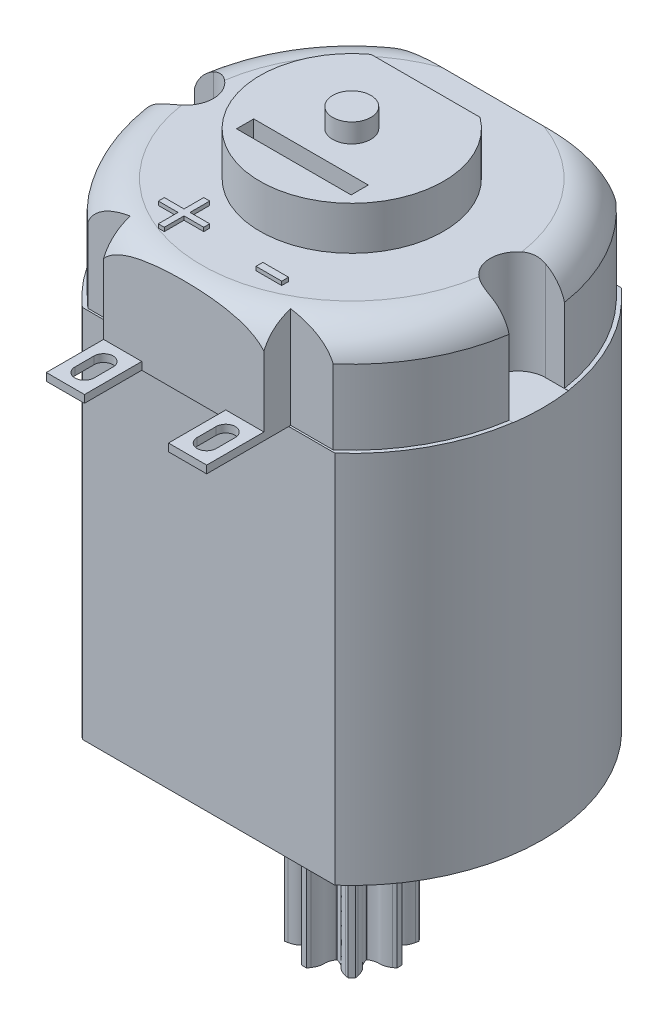
from build123d import *

# Parameters (mm, degrees)
BOSS_EXTRUDE1_DEPTH  = 9.8
BOSS_EXTRUDE2_DEPTH  = 5.4
SKETCH3_W            = 8.4
SKETCH3_H            = 5.4
BOSS_EXTRUDE3_DEPTH  = 1.4
BOSS_EXTRUDE4_DEPTH  = 2.27
SKETCH6_W            = 6
SKETCH6_H            = 0.9
CUT_EXTRUDE1_DEPTH   = 2.27
SKETCH7_R            = 3
BOSS_EXTRUDE5_DEPTH  = 1.7
SKETCH8_R            = 1
BOSS_EXTRUDE6_DEPTH  = 7.8
BOSS_EXTRUDE7_DEPTH  = 5
CUT_EXTRUDE2_DEPTH   = 5.41
BOSS_EXTRUDE8_START  = 1
SKETCH11_R           = 1
BOSS_EXTRUDE8_DEPTH  = 1
SKETCH12_W           = 2
SKETCH12_H           = 0.4
BOSS_EXTRUDE9_DEPTH  = 3
CUT_EXTRUDE3_DEPTH   = 34.309007915
SKETCH14_W           = 1.346153846
SKETCH14_H           = 0.358974359
BOSS_EXTRUDE10_DEPTH = 0.2


with BuildPart() as part:
    # Sketch1 → Boss-Extrude1 (new, symmetric)
    with BuildSketch(Plane(origin=(0, 0, 0), x_dir=(1, 0, 0), z_dir=(0, 1, 0))):
        with BuildLine():
            Line((-6.614378278, 7.5), (6.614378278, 7.5))
            ThreePointArc((6.614378278, 7.5), (10, 0), (6.614378278, -7.5))
            Line((6.614378278, -7.5), (-6.614378278, -7.5))
            ThreePointArc((-6.614378278, -7.5), (-10, 0), (-6.614378278, 7.5))
        make_face()
    extrude(amount=BOSS_EXTRUDE1_DEPTH, both=True)

    # Sketch2 → Boss-Extrude2 (add)
    with BuildSketch(Plane(origin=(0, 9.8, 0), x_dir=(1, 0, 0), z_dir=(0, 1, 0))):
        with BuildLine():
            Line((-6.424951362, 7.4), (6.424951362, 7.4))
            ThreePointArc((6.424951362, 7.4), (9.8, 0), (6.424951362, -7.4))
            Line((6.424951362, -7.4), (-6.424951362, -7.4))
            ThreePointArc((-6.424951362, -7.4), (-9.8, 0), (-6.424951362, 7.4))
        make_face()
    extrude(amount=BOSS_EXTRUDE2_DEPTH)

    # Sketch3 → Boss-Extrude3 (add)
    with BuildSketch(Plane.XY.offset(7.4)):
        with Locations((0, 12.5)):
            Rectangle(SKETCH3_W, SKETCH3_H)
    extrude(amount=BOSS_EXTRUDE3_DEPTH)

    # Sketch4 → Cut-Revolve1 (revolve, cut)
    with BuildSketch(Plane.XY):
        with BuildLine():
            Line((7.863508327, 15.2), (9.8, 15.2))
            Line((9.8, 15.2), (9.8, 13.7))
            ThreePointArc((9.8, 13.7), (9.088253198, 14.78113883), (7.863508327, 15.2))
        make_face()
    revolve(axis=Axis((0, 0, 0), (0, 1, 0)), mode=Mode.SUBTRACT)

    # Sketch5 → Boss-Extrude4 (add)
    with BuildSketch(Plane(origin=(0, 15.2, 0), x_dir=(1, 0, 0), z_dir=(0, 1, 0))):
        with BuildLine():
            Line((-2.854785456, 3.865), (2.854785456, 3.865))
            ThreePointArc((2.854785456, 3.865), (0, -4.805), (-2.854785456, 3.865))
        make_face()
    extrude(amount=BOSS_EXTRUDE4_DEPTH)

    # Sketch6 → Cut-Extrude1 (cut)
    with BuildSketch(Plane(origin=(0, 17.47, 0), x_dir=(1, 0, 0), z_dir=(0, 1, 0))):
        with Locations((0, -2.585)):
            Rectangle(SKETCH6_W, SKETCH6_H)
    extrude(amount=-CUT_EXTRUDE1_DEPTH, mode=Mode.SUBTRACT)

    # Sketch7 → Boss-Extrude5 (add)
    with BuildSketch(Plane.XZ.offset(9.8)):
        with Locations(Location((0, 0, 0), (0, 0, 90))):
            Circle(SKETCH7_R)
    extrude(amount=BOSS_EXTRUDE5_DEPTH)

    # Sketch8 → Boss-Extrude6 (add)
    with BuildSketch(Plane.XZ.offset(11.5)):
        with Locations(Location((0, 0, 0), (0, 0, 90))):
            Circle(SKETCH8_R)
    extrude(amount=BOSS_EXTRUDE6_DEPTH)

    # Sketch9 → Boss-Extrude7 (add)
    with BuildSketch(Plane.XZ.offset(19.3)):
        with BuildLine():
            ThreePointArc((-1.669543101, 1.860813218), (-1.767766953, 1.767766953), (-1.860813218, 1.669543101))
            add(Edge.make_bspline(
                [(-1.833269815, 1.509883117), (-1.834566193, 1.515562072), (-1.841050704, 1.544780098), (-1.851144596, 1.59787473), (-1.857940557, 1.64561352), (-1.860813218, 1.669543101)],
                knots=[0.861943391, 0.861943391, 0.861943391, 0.861943391, 0.875779975, 0.933034298, 0.990289165, 0.990289165, 0.990289165, 0.990289165], degree=3, weights=[1, 1, 1, 1, 1, 1]))
            add(Edge.make_bspline(
                [(-1.336758705, 0.587436437), (-1.342836623, 0.609809786), (-1.356384146, 0.655129372), (-1.380317809, 0.722419798), (-1.40879052, 0.788922672), (-1.442115809, 0.853198714), (-1.480826394, 0.914219802), (-1.523607966, 0.972930122), (-1.578039703, 1.020725028), (-1.63247144, 1.068519934), (-1.675253012, 1.127230254), (-1.713963596, 1.188251342), (-1.747288886, 1.252527384), (-1.775761596, 1.319030258), (-1.800003115, 1.387186231), (-1.818987324, 1.450923786), (-1.829201984, 1.492063442), (-1.833269815, 1.509883117)],
                knots=[0.019417437, 0.019417437, 0.019417437, 0.019417437, 0.074489366, 0.131741587, 0.188990012, 0.246235328, 0.303478373, 0.360710614, 0.417881297, 0.475051979, 0.532284221, 0.589527266, 0.646772582, 0.704021006, 0.761273228, 0.818526345, 0.86194334, 0.86194334, 0.86194334, 0.86194334], degree=3, weights=[1, 1, 1, 1, 1, 1, 1, 1, 1, 1, 1, 1, 1, 1, 1, 1, 1, 1]))
            ThreePointArc((-1.336758705, 0.587436437), (-1.332769491, 0.569422137), (-1.330500722, 0.551111444))
            ThreePointArc((-1.330500722, 0.551111444), (-1.3450526, 0.53976809), (-1.360611433, 0.529850857))
            add(Edge.make_bspline(
                [(-1.360611433, 0.529850857), (-1.380729517, 0.518328247), (-1.422354849, 0.495862006), (-1.486860021, 0.465204145), (-1.554017901, 0.438312758), (-1.623032464, 0.416427272), (-1.693553407, 0.400651363), (-1.765319011, 0.389388038), (-1.837604164, 0.394080986), (-1.909889316, 0.398773934), (-1.981654921, 0.387510608), (-2.052175863, 0.3717347), (-2.121190426, 0.349849213), (-2.188348306, 0.322957826), (-2.253683199, 0.291905618), (-2.31217632, 0.260260224), (-2.348489305, 0.238392949), (-2.363966109, 0.228668927)],
                knots=[0.019417437, 0.019417437, 0.019417437, 0.019417437, 0.074489366, 0.131741587, 0.188990012, 0.246235328, 0.303478373, 0.360710614, 0.417881297, 0.475051979, 0.532284221, 0.589527266, 0.646772582, 0.704021006, 0.761273228, 0.818526345, 0.86194334, 0.86194334, 0.86194334, 0.86194334], degree=3, weights=[1, 1, 1, 1, 1, 1, 1, 1, 1, 1, 1, 1, 1, 1, 1, 1, 1, 1]))
            add(Edge.make_bspline(
                [(-2.363966109, 0.228668927), (-2.368898414, 0.225569977), (-2.394143919, 0.209494954), (-2.438824954, 0.17908884), (-2.477386846, 0.150137888), (-2.496338893, 0.135248397)],
                knots=[0.861943391, 0.861943391, 0.861943391, 0.861943391, 0.875779975, 0.933034298, 0.990289165, 0.990289165, 0.990289165, 0.990289165], degree=3, weights=[1, 1, 1, 1, 1, 1]))
            ThreePointArc((-2.496338893, 0.135248397), (-2.5, 0), (-2.496338893, -0.135248397))
            add(Edge.make_bspline(
                [(-2.363966109, -0.228668927), (-2.368898414, -0.225569977), (-2.394143919, -0.209494954), (-2.438824954, -0.17908884), (-2.477386846, -0.150137888), (-2.496338893, -0.135248397)],
                knots=[0.861943391, 0.861943391, 0.861943391, 0.861943391, 0.875779975, 0.933034298, 0.990289165, 0.990289165, 0.990289165, 0.990289165], degree=3, weights=[1, 1, 1, 1, 1, 1]))
            add(Edge.make_bspline(
                [(-1.360611433, -0.529850857), (-1.380729517, -0.518328247), (-1.422354849, -0.495862006), (-1.486860021, -0.465204145), (-1.554017901, -0.438312758), (-1.623032464, -0.416427272), (-1.693553407, -0.400651363), (-1.765319011, -0.389388038), (-1.837604164, -0.394080986), (-1.909889316, -0.398773934), (-1.981654921, -0.387510608), (-2.052175863, -0.3717347), (-2.121190426, -0.349849213), (-2.188348306, -0.322957826), (-2.253683199, -0.291905618), (-2.31217632, -0.260260224), (-2.348489305, -0.238392949), (-2.363966109, -0.228668927)],
                knots=[0.019417437, 0.019417437, 0.019417437, 0.019417437, 0.074489366, 0.131741587, 0.188990012, 0.246235328, 0.303478373, 0.360710614, 0.417881297, 0.475051979, 0.532284221, 0.589527266, 0.646772582, 0.704021006, 0.761273228, 0.818526345, 0.86194334, 0.86194334, 0.86194334, 0.86194334], degree=3, weights=[1, 1, 1, 1, 1, 1, 1, 1, 1, 1, 1, 1, 1, 1, 1, 1, 1, 1]))
            ThreePointArc((-1.360611433, -0.529850857), (-1.3450526, -0.53976809), (-1.330500722, -0.551111444))
            ThreePointArc((-1.330500722, -0.551111444), (-1.332769491, -0.569422137), (-1.336758705, -0.587436437))
            add(Edge.make_bspline(
                [(-1.336758705, -0.587436437), (-1.342836623, -0.609809786), (-1.356384146, -0.655129372), (-1.380317809, -0.722419798), (-1.40879052, -0.788922672), (-1.442115809, -0.853198714), (-1.480826394, -0.914219802), (-1.523607966, -0.972930122), (-1.578039703, -1.020725028), (-1.63247144, -1.068519934), (-1.675253012, -1.127230254), (-1.713963596, -1.188251342), (-1.747288886, -1.252527384), (-1.775761596, -1.319030258), (-1.800003115, -1.387186231), (-1.818987324, -1.450923786), (-1.829201984, -1.492063442), (-1.833269815, -1.509883117)],
                knots=[0.019417437, 0.019417437, 0.019417437, 0.019417437, 0.074489366, 0.131741587, 0.188990012, 0.246235328, 0.303478373, 0.360710614, 0.417881297, 0.475051979, 0.532284221, 0.589527266, 0.646772582, 0.704021006, 0.761273228, 0.818526345, 0.86194334, 0.86194334, 0.86194334, 0.86194334], degree=3, weights=[1, 1, 1, 1, 1, 1, 1, 1, 1, 1, 1, 1, 1, 1, 1, 1, 1, 1]))
            add(Edge.make_bspline(
                [(-1.833269815, -1.509883117), (-1.834566193, -1.515562072), (-1.841050704, -1.544780098), (-1.851144596, -1.59787473), (-1.857940557, -1.64561352), (-1.860813218, -1.669543101)],
                knots=[0.861943391, 0.861943391, 0.861943391, 0.861943391, 0.875779975, 0.933034298, 0.990289165, 0.990289165, 0.990289165, 0.990289165], degree=3, weights=[1, 1, 1, 1, 1, 1]))
            ThreePointArc((-1.860813218, -1.669543101), (-1.767766953, -1.767766953), (-1.669543101, -1.860813218))
            add(Edge.make_bspline(
                [(-1.509883117, -1.833269815), (-1.515562072, -1.834566193), (-1.544780098, -1.841050704), (-1.59787473, -1.851144596), (-1.64561352, -1.857940557), (-1.669543101, -1.860813218)],
                knots=[0.861943391, 0.861943391, 0.861943391, 0.861943391, 0.875779975, 0.933034298, 0.990289165, 0.990289165, 0.990289165, 0.990289165], degree=3, weights=[1, 1, 1, 1, 1, 1]))
            add(Edge.make_bspline(
                [(-0.587436437, -1.336758705), (-0.609809786, -1.342836623), (-0.655129372, -1.356384146), (-0.722419798, -1.380317809), (-0.788922672, -1.40879052), (-0.853198714, -1.442115809), (-0.914219802, -1.480826394), (-0.972930122, -1.523607966), (-1.020725028, -1.578039703), (-1.068519934, -1.63247144), (-1.127230254, -1.675253012), (-1.188251342, -1.713963596), (-1.252527384, -1.747288886), (-1.319030258, -1.775761596), (-1.387186231, -1.800003115), (-1.450923786, -1.818987324), (-1.492063442, -1.829201984), (-1.509883117, -1.833269815)],
                knots=[0.019417437, 0.019417437, 0.019417437, 0.019417437, 0.074489366, 0.131741587, 0.188990012, 0.246235328, 0.303478373, 0.360710614, 0.417881297, 0.475051979, 0.532284221, 0.589527266, 0.646772582, 0.704021006, 0.761273228, 0.818526345, 0.86194334, 0.86194334, 0.86194334, 0.86194334], degree=3, weights=[1, 1, 1, 1, 1, 1, 1, 1, 1, 1, 1, 1, 1, 1, 1, 1, 1, 1]))
            ThreePointArc((-0.587436437, -1.336758705), (-0.569422137, -1.332769491), (-0.551111444, -1.330500722))
            ThreePointArc((-0.551111444, -1.330500722), (-0.53976809, -1.3450526), (-0.529850857, -1.360611433))
            add(Edge.make_bspline(
                [(-0.529850857, -1.360611433), (-0.518328247, -1.380729517), (-0.495862006, -1.422354849), (-0.465204145, -1.486860021), (-0.438312758, -1.554017901), (-0.416427272, -1.623032464), (-0.400651363, -1.693553407), (-0.389388038, -1.765319011), (-0.394080986, -1.837604164), (-0.398773934, -1.909889316), (-0.387510608, -1.981654921), (-0.3717347, -2.052175863), (-0.349849213, -2.121190426), (-0.322957826, -2.188348306), (-0.291905618, -2.253683199), (-0.260260224, -2.31217632), (-0.238392949, -2.348489305), (-0.228668927, -2.363966109)],
                knots=[0.019417437, 0.019417437, 0.019417437, 0.019417437, 0.074489366, 0.131741587, 0.188990012, 0.246235328, 0.303478373, 0.360710614, 0.417881297, 0.475051979, 0.532284221, 0.589527266, 0.646772582, 0.704021006, 0.761273228, 0.818526345, 0.86194334, 0.86194334, 0.86194334, 0.86194334], degree=3, weights=[1, 1, 1, 1, 1, 1, 1, 1, 1, 1, 1, 1, 1, 1, 1, 1, 1, 1]))
            add(Edge.make_bspline(
                [(-0.228668927, -2.363966109), (-0.225569977, -2.368898414), (-0.209494954, -2.394143919), (-0.17908884, -2.438824954), (-0.150137888, -2.477386846), (-0.135248397, -2.496338893)],
                knots=[0.861943391, 0.861943391, 0.861943391, 0.861943391, 0.875779975, 0.933034298, 0.990289165, 0.990289165, 0.990289165, 0.990289165], degree=3, weights=[1, 1, 1, 1, 1, 1]))
            ThreePointArc((-0.135248397, -2.496338893), (0, -2.5), (0.135248397, -2.496338893))
            add(Edge.make_bspline(
                [(0.228668927, -2.363966109), (0.225569977, -2.368898414), (0.209494954, -2.394143919), (0.17908884, -2.438824954), (0.150137888, -2.477386846), (0.135248397, -2.496338893)],
                knots=[0.861943391, 0.861943391, 0.861943391, 0.861943391, 0.875779975, 0.933034298, 0.990289165, 0.990289165, 0.990289165, 0.990289165], degree=3, weights=[1, 1, 1, 1, 1, 1]))
            add(Edge.make_bspline(
                [(0.529850857, -1.360611433), (0.518328247, -1.380729517), (0.495862006, -1.422354849), (0.465204145, -1.486860021), (0.438312758, -1.554017901), (0.416427272, -1.623032464), (0.400651363, -1.693553407), (0.389388038, -1.765319011), (0.394080986, -1.837604164), (0.398773934, -1.909889316), (0.387510608, -1.981654921), (0.3717347, -2.052175863), (0.349849213, -2.121190426), (0.322957826, -2.188348306), (0.291905618, -2.253683199), (0.260260224, -2.31217632), (0.238392949, -2.348489305), (0.228668927, -2.363966109)],
                knots=[0.019417437, 0.019417437, 0.019417437, 0.019417437, 0.074489366, 0.131741587, 0.188990012, 0.246235328, 0.303478373, 0.360710614, 0.417881297, 0.475051979, 0.532284221, 0.589527266, 0.646772582, 0.704021006, 0.761273228, 0.818526345, 0.86194334, 0.86194334, 0.86194334, 0.86194334], degree=3, weights=[1, 1, 1, 1, 1, 1, 1, 1, 1, 1, 1, 1, 1, 1, 1, 1, 1, 1]))
            ThreePointArc((0.529850857, -1.360611433), (0.53976809, -1.3450526), (0.551111444, -1.330500722))
            ThreePointArc((0.551111444, -1.330500722), (0.569422137, -1.332769491), (0.587436437, -1.336758705))
            add(Edge.make_bspline(
                [(0.587436437, -1.336758705), (0.609809786, -1.342836623), (0.655129372, -1.356384146), (0.722419798, -1.380317809), (0.788922672, -1.40879052), (0.853198714, -1.442115809), (0.914219802, -1.480826394), (0.972930122, -1.523607966), (1.020725028, -1.578039703), (1.068519934, -1.63247144), (1.127230254, -1.675253012), (1.188251342, -1.713963596), (1.252527384, -1.747288886), (1.319030258, -1.775761596), (1.387186231, -1.800003115), (1.450923786, -1.818987324), (1.492063442, -1.829201984), (1.509883117, -1.833269815)],
                knots=[0.019417437, 0.019417437, 0.019417437, 0.019417437, 0.074489366, 0.131741587, 0.188990012, 0.246235328, 0.303478373, 0.360710614, 0.417881297, 0.475051979, 0.532284221, 0.589527266, 0.646772582, 0.704021006, 0.761273228, 0.818526345, 0.86194334, 0.86194334, 0.86194334, 0.86194334], degree=3, weights=[1, 1, 1, 1, 1, 1, 1, 1, 1, 1, 1, 1, 1, 1, 1, 1, 1, 1]))
            add(Edge.make_bspline(
                [(1.509883117, -1.833269815), (1.515562072, -1.834566193), (1.544780098, -1.841050704), (1.59787473, -1.851144596), (1.64561352, -1.857940557), (1.669543101, -1.860813218)],
                knots=[0.861943391, 0.861943391, 0.861943391, 0.861943391, 0.875779975, 0.933034298, 0.990289165, 0.990289165, 0.990289165, 0.990289165], degree=3, weights=[1, 1, 1, 1, 1, 1]))
            ThreePointArc((1.669543101, -1.860813218), (1.767766953, -1.767766953), (1.860813218, -1.669543101))
            add(Edge.make_bspline(
                [(1.833269815, -1.509883117), (1.834566193, -1.515562072), (1.841050704, -1.544780098), (1.851144596, -1.59787473), (1.857940557, -1.64561352), (1.860813218, -1.669543101)],
                knots=[0.861943391, 0.861943391, 0.861943391, 0.861943391, 0.875779975, 0.933034298, 0.990289165, 0.990289165, 0.990289165, 0.990289165], degree=3, weights=[1, 1, 1, 1, 1, 1]))
            add(Edge.make_bspline(
                [(1.336758705, -0.587436437), (1.342836623, -0.609809786), (1.356384146, -0.655129372), (1.380317809, -0.722419798), (1.40879052, -0.788922672), (1.442115809, -0.853198714), (1.480826394, -0.914219802), (1.523607966, -0.972930122), (1.578039703, -1.020725028), (1.63247144, -1.068519934), (1.675253012, -1.127230254), (1.713963596, -1.188251342), (1.747288886, -1.252527384), (1.775761596, -1.319030258), (1.800003115, -1.387186231), (1.818987324, -1.450923786), (1.829201984, -1.492063442), (1.833269815, -1.509883117)],
                knots=[0.019417437, 0.019417437, 0.019417437, 0.019417437, 0.074489366, 0.131741587, 0.188990012, 0.246235328, 0.303478373, 0.360710614, 0.417881297, 0.475051979, 0.532284221, 0.589527266, 0.646772582, 0.704021006, 0.761273228, 0.818526345, 0.86194334, 0.86194334, 0.86194334, 0.86194334], degree=3, weights=[1, 1, 1, 1, 1, 1, 1, 1, 1, 1, 1, 1, 1, 1, 1, 1, 1, 1]))
            ThreePointArc((1.336758705, -0.587436437), (1.332769491, -0.569422137), (1.330500722, -0.551111444))
            ThreePointArc((1.330500722, -0.551111444), (1.3450526, -0.53976809), (1.360611433, -0.529850857))
            add(Edge.make_bspline(
                [(1.360611433, -0.529850857), (1.380729517, -0.518328247), (1.422354849, -0.495862006), (1.486860021, -0.465204145), (1.554017901, -0.438312758), (1.623032464, -0.416427272), (1.693553407, -0.400651363), (1.765319011, -0.389388038), (1.837604164, -0.394080986), (1.909889316, -0.398773934), (1.981654921, -0.387510608), (2.052175863, -0.3717347), (2.121190426, -0.349849213), (2.188348306, -0.322957826), (2.253683199, -0.291905618), (2.31217632, -0.260260224), (2.348489305, -0.238392949), (2.363966109, -0.228668927)],
                knots=[0.019417437, 0.019417437, 0.019417437, 0.019417437, 0.074489366, 0.131741587, 0.188990012, 0.246235328, 0.303478373, 0.360710614, 0.417881297, 0.475051979, 0.532284221, 0.589527266, 0.646772582, 0.704021006, 0.761273228, 0.818526345, 0.86194334, 0.86194334, 0.86194334, 0.86194334], degree=3, weights=[1, 1, 1, 1, 1, 1, 1, 1, 1, 1, 1, 1, 1, 1, 1, 1, 1, 1]))
            add(Edge.make_bspline(
                [(2.363966109, -0.228668927), (2.368898414, -0.225569977), (2.394143919, -0.209494954), (2.438824954, -0.17908884), (2.477386846, -0.150137888), (2.496338893, -0.135248397)],
                knots=[0.861943391, 0.861943391, 0.861943391, 0.861943391, 0.875779975, 0.933034298, 0.990289165, 0.990289165, 0.990289165, 0.990289165], degree=3, weights=[1, 1, 1, 1, 1, 1]))
            ThreePointArc((2.496338893, -0.135248397), (2.5, 0), (2.496338893, 0.135248397))
            add(Edge.make_bspline(
                [(2.363966109, 0.228668927), (2.368898414, 0.225569977), (2.394143919, 0.209494954), (2.438824954, 0.17908884), (2.477386846, 0.150137888), (2.496338893, 0.135248397)],
                knots=[0.861943391, 0.861943391, 0.861943391, 0.861943391, 0.875779975, 0.933034298, 0.990289165, 0.990289165, 0.990289165, 0.990289165], degree=3, weights=[1, 1, 1, 1, 1, 1]))
            add(Edge.make_bspline(
                [(1.360611433, 0.529850857), (1.380729517, 0.518328247), (1.422354849, 0.495862006), (1.486860021, 0.465204145), (1.554017901, 0.438312758), (1.623032464, 0.416427272), (1.693553407, 0.400651363), (1.765319011, 0.389388038), (1.837604164, 0.394080986), (1.909889316, 0.398773934), (1.981654921, 0.387510608), (2.052175863, 0.3717347), (2.121190426, 0.349849213), (2.188348306, 0.322957826), (2.253683199, 0.291905618), (2.31217632, 0.260260224), (2.348489305, 0.238392949), (2.363966109, 0.228668927)],
                knots=[0.019417437, 0.019417437, 0.019417437, 0.019417437, 0.074489366, 0.131741587, 0.188990012, 0.246235328, 0.303478373, 0.360710614, 0.417881297, 0.475051979, 0.532284221, 0.589527266, 0.646772582, 0.704021006, 0.761273228, 0.818526345, 0.86194334, 0.86194334, 0.86194334, 0.86194334], degree=3, weights=[1, 1, 1, 1, 1, 1, 1, 1, 1, 1, 1, 1, 1, 1, 1, 1, 1, 1]))
            ThreePointArc((1.360611433, 0.529850857), (1.3450526, 0.53976809), (1.330500722, 0.551111444))
            ThreePointArc((1.330500722, 0.551111444), (1.332769491, 0.569422137), (1.336758705, 0.587436437))
            add(Edge.make_bspline(
                [(1.336758705, 0.587436437), (1.342836623, 0.609809786), (1.356384146, 0.655129372), (1.380317809, 0.722419798), (1.40879052, 0.788922672), (1.442115809, 0.853198714), (1.480826394, 0.914219802), (1.523607966, 0.972930122), (1.578039703, 1.020725028), (1.63247144, 1.068519934), (1.675253012, 1.127230254), (1.713963596, 1.188251342), (1.747288886, 1.252527384), (1.775761596, 1.319030258), (1.800003115, 1.387186231), (1.818987324, 1.450923786), (1.829201984, 1.492063442), (1.833269815, 1.509883117)],
                knots=[0.019417437, 0.019417437, 0.019417437, 0.019417437, 0.074489366, 0.131741587, 0.188990012, 0.246235328, 0.303478373, 0.360710614, 0.417881297, 0.475051979, 0.532284221, 0.589527266, 0.646772582, 0.704021006, 0.761273228, 0.818526345, 0.86194334, 0.86194334, 0.86194334, 0.86194334], degree=3, weights=[1, 1, 1, 1, 1, 1, 1, 1, 1, 1, 1, 1, 1, 1, 1, 1, 1, 1]))
            add(Edge.make_bspline(
                [(1.833269815, 1.509883117), (1.834566193, 1.515562072), (1.841050704, 1.544780098), (1.851144596, 1.59787473), (1.857940557, 1.64561352), (1.860813218, 1.669543101)],
                knots=[0.861943391, 0.861943391, 0.861943391, 0.861943391, 0.875779975, 0.933034298, 0.990289165, 0.990289165, 0.990289165, 0.990289165], degree=3, weights=[1, 1, 1, 1, 1, 1]))
            ThreePointArc((1.860813218, 1.669543101), (1.767766953, 1.767766953), (1.669543101, 1.860813218))
            add(Edge.make_bspline(
                [(1.509883117, 1.833269815), (1.515562072, 1.834566193), (1.544780098, 1.841050704), (1.59787473, 1.851144596), (1.64561352, 1.857940557), (1.669543101, 1.860813218)],
                knots=[0.861943391, 0.861943391, 0.861943391, 0.861943391, 0.875779975, 0.933034298, 0.990289165, 0.990289165, 0.990289165, 0.990289165], degree=3, weights=[1, 1, 1, 1, 1, 1]))
            add(Edge.make_bspline(
                [(0.587436437, 1.336758705), (0.609809786, 1.342836623), (0.655129372, 1.356384146), (0.722419798, 1.380317809), (0.788922672, 1.40879052), (0.853198714, 1.442115809), (0.914219802, 1.480826394), (0.972930122, 1.523607966), (1.020725028, 1.578039703), (1.068519934, 1.63247144), (1.127230254, 1.675253012), (1.188251342, 1.713963596), (1.252527384, 1.747288886), (1.319030258, 1.775761596), (1.387186231, 1.800003115), (1.450923786, 1.818987324), (1.492063442, 1.829201984), (1.509883117, 1.833269815)],
                knots=[0.019417437, 0.019417437, 0.019417437, 0.019417437, 0.074489366, 0.131741587, 0.188990012, 0.246235328, 0.303478373, 0.360710614, 0.417881297, 0.475051979, 0.532284221, 0.589527266, 0.646772582, 0.704021006, 0.761273228, 0.818526345, 0.86194334, 0.86194334, 0.86194334, 0.86194334], degree=3, weights=[1, 1, 1, 1, 1, 1, 1, 1, 1, 1, 1, 1, 1, 1, 1, 1, 1, 1]))
            ThreePointArc((0.587436437, 1.336758705), (0.569422137, 1.332769491), (0.551111444, 1.330500722))
            ThreePointArc((0.551111444, 1.330500722), (0.53976809, 1.3450526), (0.529850857, 1.360611433))
            add(Edge.make_bspline(
                [(0.529850857, 1.360611433), (0.518328247, 1.380729517), (0.495862006, 1.422354849), (0.465204145, 1.486860021), (0.438312758, 1.554017901), (0.416427272, 1.623032464), (0.400651363, 1.693553407), (0.389388038, 1.765319011), (0.394080986, 1.837604164), (0.398773934, 1.909889316), (0.387510608, 1.981654921), (0.3717347, 2.052175863), (0.349849213, 2.121190426), (0.322957826, 2.188348306), (0.291905618, 2.253683199), (0.260260224, 2.31217632), (0.238392949, 2.348489305), (0.228668927, 2.363966109)],
                knots=[0.019417437, 0.019417437, 0.019417437, 0.019417437, 0.074489366, 0.131741587, 0.188990012, 0.246235328, 0.303478373, 0.360710614, 0.417881297, 0.475051979, 0.532284221, 0.589527266, 0.646772582, 0.704021006, 0.761273228, 0.818526345, 0.86194334, 0.86194334, 0.86194334, 0.86194334], degree=3, weights=[1, 1, 1, 1, 1, 1, 1, 1, 1, 1, 1, 1, 1, 1, 1, 1, 1, 1]))
            add(Edge.make_bspline(
                [(0.228668927, 2.363966109), (0.225569977, 2.368898414), (0.209494954, 2.394143919), (0.17908884, 2.438824954), (0.150137888, 2.477386846), (0.135248397, 2.496338893)],
                knots=[0.861943391, 0.861943391, 0.861943391, 0.861943391, 0.875779975, 0.933034298, 0.990289165, 0.990289165, 0.990289165, 0.990289165], degree=3, weights=[1, 1, 1, 1, 1, 1]))
            ThreePointArc((0.135248397, 2.496338893), (0, 2.5), (-0.135248397, 2.496338893))
            add(Edge.make_bspline(
                [(-0.228668927, 2.363966109), (-0.225569977, 2.368898414), (-0.209494954, 2.394143919), (-0.17908884, 2.438824954), (-0.150137888, 2.477386846), (-0.135248397, 2.496338893)],
                knots=[0.861943391, 0.861943391, 0.861943391, 0.861943391, 0.875779975, 0.933034298, 0.990289165, 0.990289165, 0.990289165, 0.990289165], degree=3, weights=[1, 1, 1, 1, 1, 1]))
            add(Edge.make_bspline(
                [(-0.529850857, 1.360611433), (-0.518328247, 1.380729517), (-0.495862006, 1.422354849), (-0.465204145, 1.486860021), (-0.438312758, 1.554017901), (-0.416427272, 1.623032464), (-0.400651363, 1.693553407), (-0.389388038, 1.765319011), (-0.394080986, 1.837604164), (-0.398773934, 1.909889316), (-0.387510608, 1.981654921), (-0.3717347, 2.052175863), (-0.349849213, 2.121190426), (-0.322957826, 2.188348306), (-0.291905618, 2.253683199), (-0.260260224, 2.31217632), (-0.238392949, 2.348489305), (-0.228668927, 2.363966109)],
                knots=[0.019417437, 0.019417437, 0.019417437, 0.019417437, 0.074489366, 0.131741587, 0.188990012, 0.246235328, 0.303478373, 0.360710614, 0.417881297, 0.475051979, 0.532284221, 0.589527266, 0.646772582, 0.704021006, 0.761273228, 0.818526345, 0.86194334, 0.86194334, 0.86194334, 0.86194334], degree=3, weights=[1, 1, 1, 1, 1, 1, 1, 1, 1, 1, 1, 1, 1, 1, 1, 1, 1, 1]))
            ThreePointArc((-0.529850857, 1.360611433), (-0.53976809, 1.3450526), (-0.551111444, 1.330500722))
            ThreePointArc((-0.551111444, 1.330500722), (-0.569422137, 1.332769491), (-0.587436437, 1.336758705))
            add(Edge.make_bspline(
                [(-0.587436437, 1.336758705), (-0.609809786, 1.342836623), (-0.655129372, 1.356384146), (-0.722419798, 1.380317809), (-0.788922672, 1.40879052), (-0.853198714, 1.442115809), (-0.914219802, 1.480826394), (-0.972930122, 1.523607966), (-1.020725028, 1.578039703), (-1.068519934, 1.63247144), (-1.127230254, 1.675253012), (-1.188251342, 1.713963596), (-1.252527384, 1.747288886), (-1.319030258, 1.775761596), (-1.387186231, 1.800003115), (-1.450923786, 1.818987324), (-1.492063442, 1.829201984), (-1.509883117, 1.833269815)],
                knots=[0.019417437, 0.019417437, 0.019417437, 0.019417437, 0.074489366, 0.131741587, 0.188990012, 0.246235328, 0.303478373, 0.360710614, 0.417881297, 0.475051979, 0.532284221, 0.589527266, 0.646772582, 0.704021006, 0.761273228, 0.818526345, 0.86194334, 0.86194334, 0.86194334, 0.86194334], degree=3, weights=[1, 1, 1, 1, 1, 1, 1, 1, 1, 1, 1, 1, 1, 1, 1, 1, 1, 1]))
            add(Edge.make_bspline(
                [(-1.509883117, 1.833269815), (-1.515562072, 1.834566193), (-1.544780098, 1.841050704), (-1.59787473, 1.851144596), (-1.64561352, 1.857940557), (-1.669543101, 1.860813218)],
                knots=[0.861943391, 0.861943391, 0.861943391, 0.861943391, 0.875779975, 0.933034298, 0.990289165, 0.990289165, 0.990289165, 0.990289165], degree=3, weights=[1, 1, 1, 1, 1, 1]))
        make_face()
    extrude(amount=-BOSS_EXTRUDE7_DEPTH)

    # Sketch10 → Cut-Extrude2 (cut)
    with BuildSketch(Plane(origin=(0, 15.2, 0), x_dir=(1, 0, 0), z_dir=(0, 1, 0))):
        with BuildLine():
            Line((-11.419795517, 1.45), (-8.7, 1.45))
            ThreePointArc((-8.7, 1.45), (-7.25, 0), (-8.7, -1.45))
            Line((-8.7, -1.45), (-11.419795517, -1.45))
            ThreePointArc((-11.419795517, -1.45), (-12.869795517, 0), (-11.419795517, 1.45))
        make_face()
        with BuildLine():
            Line((11.419795517, 1.45), (8.7, 1.45))
            ThreePointArc((8.7, 1.45), (7.25, 0), (8.7, -1.45))
            Line((8.7, -1.45), (11.419795517, -1.45))
            ThreePointArc((11.419795517, -1.45), (12.869795517, 0), (11.419795517, 1.45))
        make_face()
    extrude(amount=-CUT_EXTRUDE2_DEPTH, mode=Mode.SUBTRACT)

    # Sketch11 → Boss-Extrude8 (add)
    with BuildSketch(Plane(origin=(0, 17.47, 0), x_dir=(1, 0, 0), z_dir=(0, 1, 0)).offset(BOSS_EXTRUDE8_START)):
        with Locations(Location((0, 0, 0), (0, 0, 90))):
            Circle(SKETCH11_R)
    extrude(amount=-BOSS_EXTRUDE8_DEPTH)

    # Sketch12 → Boss-Extrude9 (add)
    with BuildSketch(Plane.XY.offset(8.8)):
        with Locations((-3.2, 10)):
            Rectangle(SKETCH12_W, SKETCH12_H)
        with Locations((3.2, 10)):
            Rectangle(SKETCH12_W, SKETCH12_H)
    extrude(amount=BOSS_EXTRUDE9_DEPTH)

    # Sketch13 → Cut-Extrude3 (cut, through all)
    with BuildSketch(Plane(origin=(0, 10.2, 0), x_dir=(1, 0, 0), z_dir=(0, 1, 0))):
        with BuildLine():
            Line((-2.7, -9.8), (-2.7, -10.8))
            ThreePointArc((-2.7, -10.8), (-3.2, -11.3), (-3.7, -10.8))
            Line((-3.7, -10.8), (-3.7, -9.8))
            ThreePointArc((-3.7, -9.8), (-3.2, -9.3), (-2.7, -9.8))
        make_face()
        with BuildLine():
            Line((2.7, -9.8), (2.7, -10.8))
            ThreePointArc((2.7, -10.8), (3.2, -11.3), (3.7, -10.8))
            Line((3.7, -10.8), (3.7, -9.8))
            ThreePointArc((3.7, -9.8), (3.2, -9.3), (2.7, -9.8))
        make_face()
    extrude(amount=-CUT_EXTRUDE3_DEPTH, mode=Mode.SUBTRACT)

    # Sketch14 → Boss-Extrude10 (add)
    with BuildSketch(Plane(origin=(0, 15.2, 0), x_dir=(1, 0, 0), z_dir=(0, 1, 0))):
        Polygon((-2.810757478, -5.975101454), (-2.810757478, -4.943050171), (-2.496654914, -4.943050171), (-2.496654914, -5.975101454), (-1.464603631, -5.975101454), (-1.464603631, -6.289204018), (-2.496654914, -6.289204018), (-2.496654914, -7.3212553), (-2.810757478, -7.3212553), (-2.810757478, -6.289204018), (-3.84280876, -6.289204018), (-3.84280876, -5.975101454), align=None)
        with Locations((2.349498933, -6.513562992)):
            Rectangle(SKETCH14_W, SKETCH14_H)
    extrude(amount=BOSS_EXTRUDE10_DEPTH)


solid = part.part
